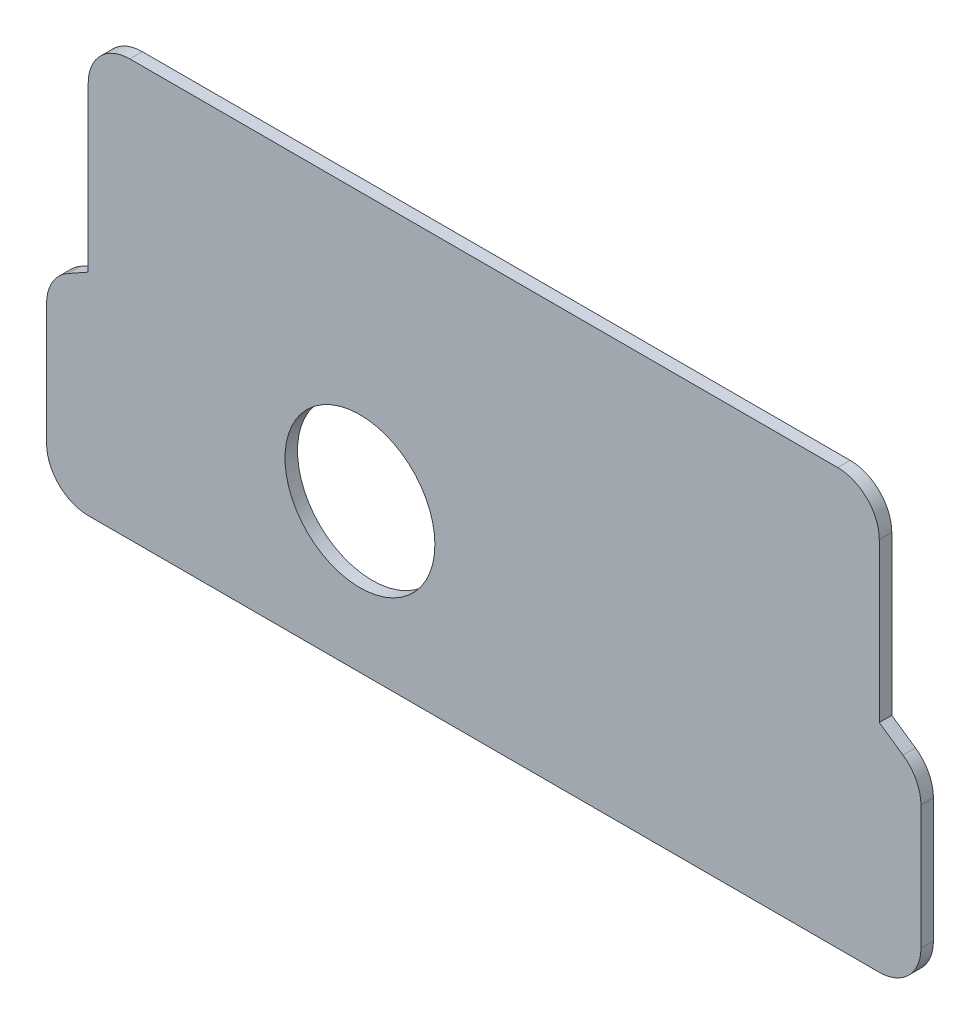
from build123d import *

# Parameters (mm, degrees)
SKETCH_1_R      = 18
EXTRUDE_1_DEPTH = 3


with BuildPart() as part:
    # 草图1 → 凸台-拉伸1 (new body)
    with BuildSketch(Plane.XY):
        with BuildLine():
            Line((0, 10), (0, 39.186569494))
            ThreePointArc((0, 39.186569494), (1.375838219, 44.248568464), (5.124766715, 47.917669105))
            Line((5.124766715, 47.917669105), (10, 50.639880584))
            Line((10, 50.639880584), (10, 90))
            ThreePointArc((10, 90), (12.928932188, 97.071067812), (20, 100))
            Line((20, 100), (190, 100))
            ThreePointArc((190, 100), (197.071067812, 97.071067812), (200, 90))
            Line((200, 90), (200, 51.963395008))
            Line((200, 51.963395008), (205.683304945, 48.037782396))
            ThreePointArc((205.683304945, 48.037782396), (208.855310538, 44.455580593), (210, 39.809778695))
            Line((210, 39.809778695), (210, 10))
            ThreePointArc((210, 10), (207.071067812, 2.928932188), (200, 0))
            Line((200, 0), (10, 0))
            ThreePointArc((10, 0), (2.928932188, 2.928932188), (0, 10))
        make_face()
        with Locations((75.264593403, 35.622477185)):
            Circle(SKETCH_1_R, mode=Mode.SUBTRACT)
    extrude(amount=EXTRUDE_1_DEPTH)


solid = part.part
